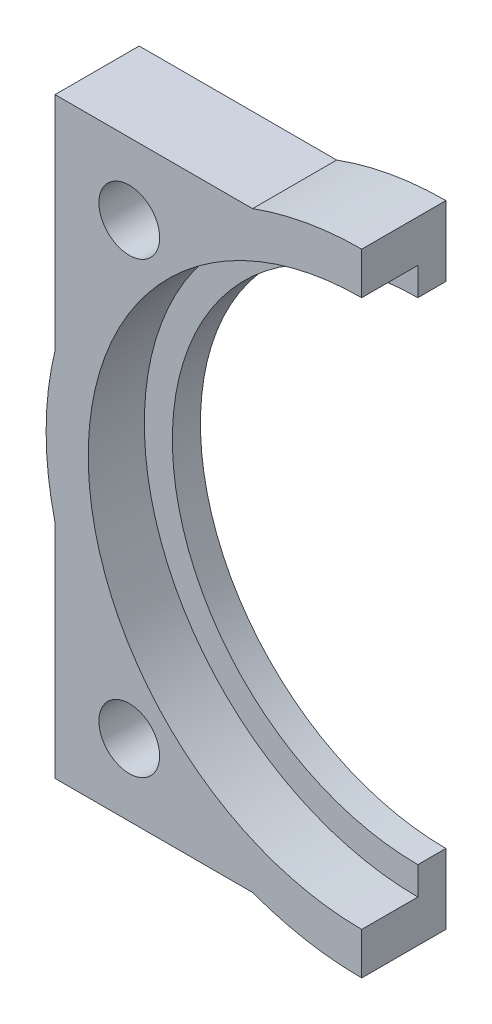
from build123d import *

# Parameters (mm, degrees)
SKETCH1_R           = 22.4995417
SKETCH1_R_2         = 17.4995417
BOSS_EXTRUDE1_DEPTH = 6
CUT_EXTRUDE1_START  = -4
SKETCH2_R           = 19.4995417
SKETCH2_R_2         = 17.4995417
CUT_EXTRUDE1_DEPTH  = 4
BOSS_EXTRUDE2_DEPTH = 6
BOSS_EXTRUDE3_START = 24
BOSS_EXTRUDE3_DEPTH = 24
BOSS_EXTRUDE4_START = 5
SKETCH6_R           = 22.4995417
SKETCH6_R_2         = 8.79453705
BOSS_EXTRUDE4_DEPTH = 5
CUT_EXTRUDE2_DEPTH  = 50
SKETCH8_W           = 26.34206851
SKETCH8_H           = 62.78523096
CUT_EXTRUDE3_DEPTH  = 44.051814752
SKETCH9_R           = 2.165
CUT_EXTRUDE4_DEPTH  = 33.379912807


with BuildPart() as part:
    # Sketch1 → Boss-Extrude1 (new body)
    with BuildSketch(Plane.XY):
        Circle(SKETCH1_R)
        Circle(SKETCH1_R_2, mode=Mode.SUBTRACT)
    extrude(amount=BOSS_EXTRUDE1_DEPTH)

    # Sketch2 → Cut-Extrude1 (cut)
    with BuildSketch(Plane.XY.offset(6).offset(CUT_EXTRUDE1_START)):
        Circle(SKETCH2_R)
        Circle(SKETCH2_R_2, mode=Mode.SUBTRACT)
    extrude(amount=CUT_EXTRUDE1_DEPTH, mode=Mode.SUBTRACT)

    # Sketch3 → Boss-Extrude2 (add, through all)
    with BuildSketch(Plane(origin=(0, 0, 0), x_dir=(-1, 0, 0), z_dir=(0, 0, -1))):
        with BuildLine():
            Line((-7.783576547, 21.11031295), (-21.864631522, 21.11031295))
            Line((-21.864631522, 21.11031295), (-21.864631522, 5.307284156))
            ThreePointArc((-21.864631522, 5.307284156), (-16.798452018, 14.96801211), (-7.783576547, 21.11031295))
        make_face()
        with BuildLine():
            Line((21.864631522, -21.11031295), (7.783576547, -21.11031295))
            ThreePointArc((7.783576547, -21.11031295), (16.798452018, -14.96801211), (21.864631522, -5.307284156))
            Line((21.864631522, -5.307284156), (21.864631522, -21.11031295))
        make_face()
        with BuildLine():
            Line((21.864631522, 21.11031295), (7.783576547, 21.11031295))
            ThreePointArc((7.783576547, 21.11031295), (16.798452018, 14.96801211), (21.864631522, 5.307284156))
            Line((21.864631522, 5.307284156), (21.864631522, 21.11031295))
        make_face()
        with BuildLine():
            Line((-21.864631522, -21.11031295), (-21.864631522, -5.307284156))
            ThreePointArc((-21.864631522, -5.307284156), (-16.798452018, -14.96801211), (-7.783576547, -21.11031295))
            Line((-7.783576547, -21.11031295), (-21.864631522, -21.11031295))
        make_face()
    extrude(amount=-BOSS_EXTRUDE2_DEPTH)

    # Sketch5 → Boss-Extrude3 (add)
    with BuildSketch(Plane(origin=(0, 0, 0), x_dir=(-1, 0, 0), z_dir=(0, 0, -1)).offset(BOSS_EXTRUDE3_START)):
        with BuildLine():
            Line((-14.441527519, 9.883129191), (-18.5677863, 12.706954341))
            ThreePointArc((-18.5677863, 12.706954341), (-22.4995417, 0), (-18.5677863, -12.706954341))
            Line((-18.5677863, -12.706954341), (-14.441527519, -9.883129191))
            ThreePointArc((-14.441527519, -9.883129191), (-17.4995417, 0), (-14.441527519, 9.883129191))
        make_face()
    extrude(amount=-BOSS_EXTRUDE3_DEPTH)

    # Sketch6 → Boss-Extrude4 (add)
    with BuildSketch(Plane(origin=(0, 0, -24), x_dir=(-1, 0, 0), z_dir=(0, 0, -1)).offset(BOSS_EXTRUDE4_START)):
        Circle(SKETCH6_R)
        Circle(SKETCH6_R_2, mode=Mode.SUBTRACT)
    extrude(amount=-BOSS_EXTRUDE4_DEPTH)

    # Sketch7 → Cut-Extrude2 (cut, symmetric)
    with BuildSketch(Plane(origin=(0, 0, 0), x_dir=(-1, 0, 0), z_dir=(0, 0, -1))):
        Polygon((0, 20.425006128), (0, -31.813494394), (-34.413040629, -24.963896379), (-30.369302041, 32.308646058), (-0.660202218, 29.585311907), (0, 25.789149152), align=None)
    extrude(amount=CUT_EXTRUDE2_DEPTH, both=True, mode=Mode.SUBTRACT)


with BuildPart() as cut_extrude2_piece_1:
    # of the separate pieces the step leaves, piece 1, a body of its own (cut_extrude2_pieces)
    add(part.part.solids().sort_by_distance((0, -22.4995417, -24))[0])

    # Sketch8 → Cut-Extrude3 (cut, through all)
    with BuildSketch(Plane(origin=(0, 0, 0), x_dir=(0, 0, -1), z_dir=(1, 0, 0))):
        with Locations((23.482670262, -0.940788161)):
            Rectangle(SKETCH8_W, SKETCH8_H)
    extrude(amount=-CUT_EXTRUDE3_DEPTH, mode=Mode.SUBTRACT)


with BuildPart() as cut_extrude2_piece_2:
    # of the separate pieces the step leaves, piece 2, a body of its own (cut_extrude2_pieces)
    add(part.part.solids().sort_by_distance((0, 17.4995417, 0))[0])

    # Sketch9 → Cut-Extrude4 (cut, through all)
    with BuildSketch(Plane(origin=(0, 0, 0), x_dir=(-1, 0, 0), z_dir=(0, 0, -1))):
        with Locations((16.571715691, 16)):
            Circle(SKETCH9_R)
        with Locations((16.571715691, -16)):
            Circle(SKETCH9_R)
        with Locations((-16.571715691, -16)):
            Circle(SKETCH9_R)
        with Locations((-16.571715691, 16)):
            Circle(SKETCH9_R)
    extrude(amount=-CUT_EXTRUDE4_DEPTH, mode=Mode.SUBTRACT)


solid = cut_extrude2_piece_2.part
